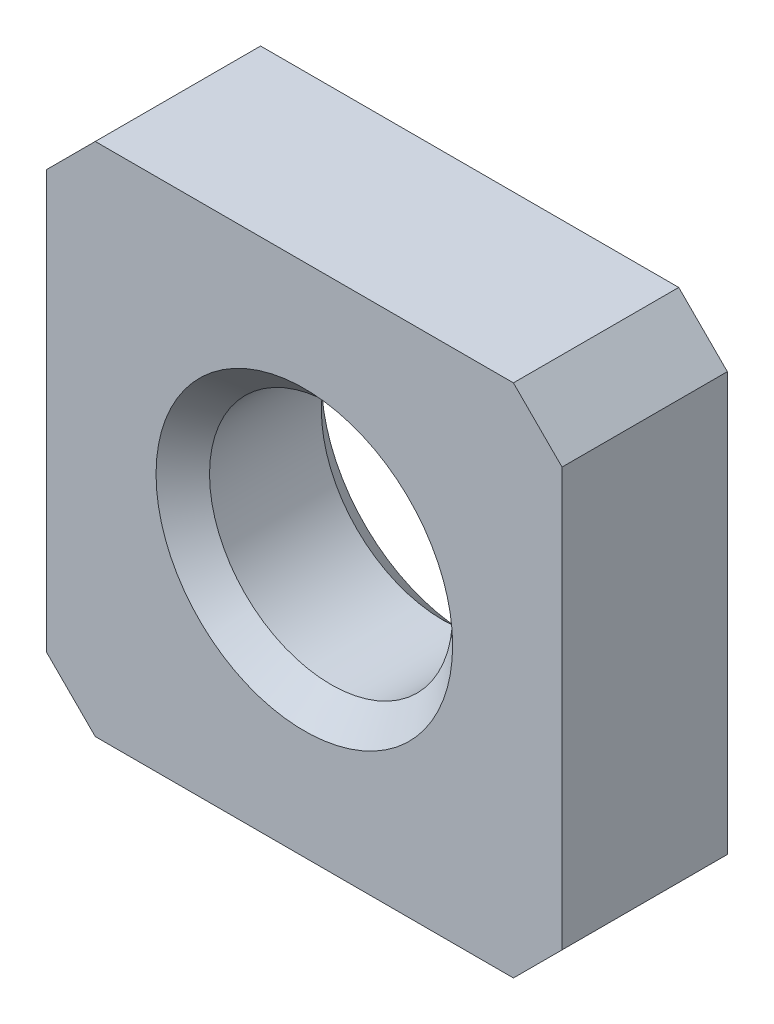
from build123d import *

# Parameters (mm, degrees)
SKETCH_1_W      = 5.3
SKETCH_1_H      = 5.3
EXTRUDE_1_DEPTH = 1.7
CHAMFER_1_SIZE  = 0.5


with BuildPart() as part:
    # 草图1 → 凸台-拉伸1 (new body)
    with BuildSketch(Plane.XY):
        Rectangle(SKETCH_1_W, SKETCH_1_H)
    extrude(amount=EXTRUDE_1_DEPTH)

    # 草图3 → M3 螺纹孔1 (revolve, cut)
    with BuildSketch(Plane(origin=(0, 0, 1.7), x_dir=(0, -1, 0), z_dir=(1, 0, 0))):
        Polygon((0, 0), (0, 1.7), (1.525, 1.7), (1.25, 1.425), (1.25, 0.275), (1.525, 0), align=None)
    revolve(axis=Axis((0, 0, 8.05), (0, 0, -1)), mode=Mode.SUBTRACT)

    # 倒角1
    chamfer_1_edges = [part.edges().sort_by_distance(p)[0] for p in [
        (2.65, -2.65, 0.85),
        (-2.65, -2.65, 0.85),
        (-2.65, 2.65, 0.85),
        (2.65, 2.65, 0.85),
    ]]
    chamfer(chamfer_1_edges, length=CHAMFER_1_SIZE)


solid = part.part
